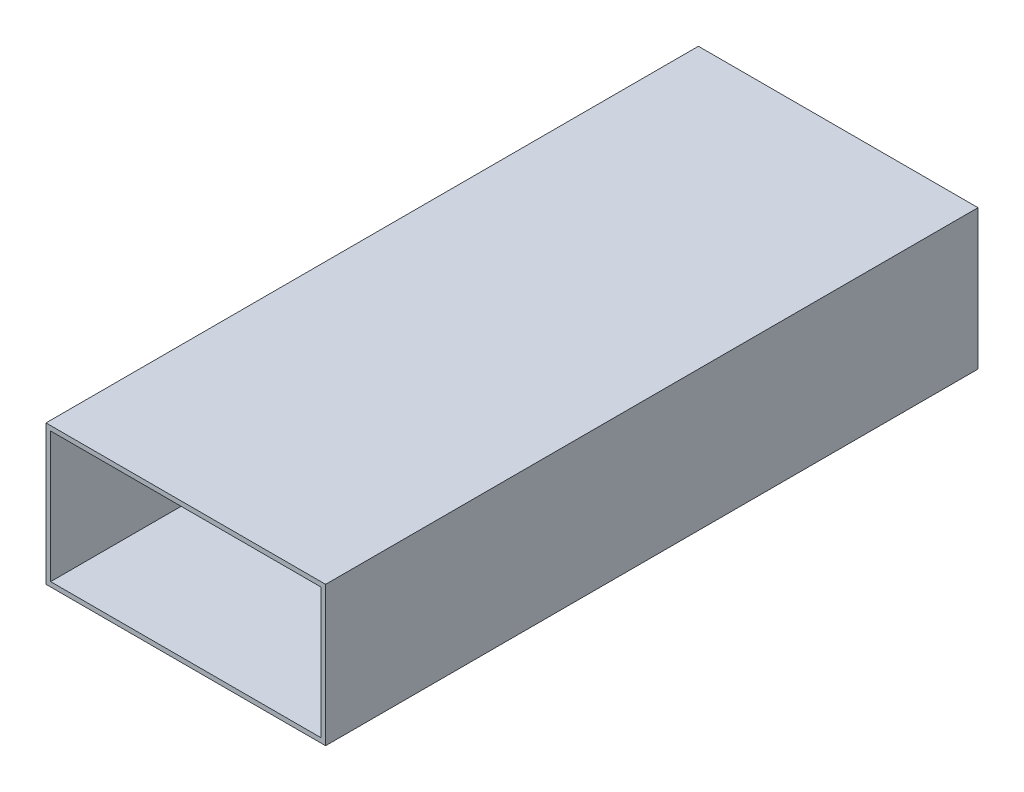
from build123d import *

# Parameters (mm, degrees)
SKETCH_1_W      = 60
SKETCH_1_H      = 30
SKETCH_1_W_2    = 58
SKETCH_1_H_2    = 28
EXTRUDE_1_DEPTH = 140


with BuildPart() as part:
    # 草图1 → 凸台-拉伸1 (new body)
    with BuildSketch(Plane.XY):
        with Locations((30, 15)):
            Rectangle(SKETCH_1_W, SKETCH_1_H)
        with Locations((30, 15)):
            Rectangle(SKETCH_1_W_2, SKETCH_1_H_2, mode=Mode.SUBTRACT)
    extrude(amount=EXTRUDE_1_DEPTH)


solid = part.part
